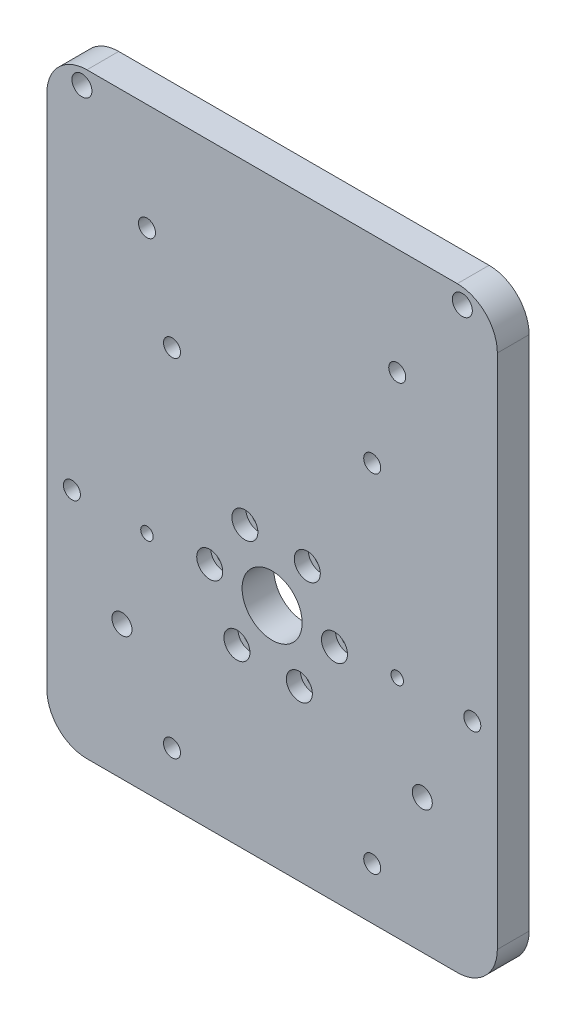
from build123d import *

# Parameters (mm, degrees)
DISCO_1_4IN_START                         = 83.85
DISCO_1_4IN_DEPTH                         = 6.35
BARRENOS_M1_ARO_ESCUADRAS_PASADORES_START = 83.85
CROQUIS16_R                               = 1.45
CROQUIS16_R_2                             = 1.25
CROQUIS16_R_3                             = 6
CROQUIS16_R_4                             = 2
BARRENOS_M1_ARO_ESCUADRAS_PASADORES_DEPTH = 6.35
REFRENTADO_M2_5_START                     = 87.4
CROQUIS17_R                               = 2.6
REFRENTADO_M2_5_DEPTH                     = 2.8
PASO_M3_ESCUADRAS_TUERCA_START            = 83.85
CROQUIS18_R                               = 1.7
PASO_M3_ESCUADRAS_TUERCA_DEPTH            = 6.35
PASO_M3_ARO_TUERCA_START                  = 83.85
CROQUIS19_R                               = 1.7
PASO_M3_ARO_TUERCA_DEPTH                  = 6.35


with BuildPart() as part:
    # Croquis15 → Disco_1-4in (new body)
    with BuildSketch(Plane.XY.offset(DISCO_1_4IN_START)):
        with BuildLine():
            Line((-37, -45), (37, -45))
            ThreePointArc((37, -45), (42.656854249, -42.656854249), (45, -37))
            Line((45, -37), (45, 66.2))
            ThreePointArc((45, 66.2), (42.656854249, 71.856854249), (37, 74.2))
            Line((37, 74.2), (-37, 74.2))
            ThreePointArc((-37, 74.2), (-42.656854249, 71.856854249), (-45, 66.2))
            Line((-45, 66.2), (-45, -37))
            ThreePointArc((-45, -37), (-42.656854249, -42.656854249), (-37, -45))
        make_face()
    extrude(amount=DISCO_1_4IN_DEPTH)

    # Croquis16 → Barrenos_M1_aro_escuadras_pasadores (cut)
    with BuildSketch(Plane.XY.offset(BARRENOS_M1_ARO_ESCUADRAS_PASADORES_START)):
        with Locations(Location((7.026042223, 10.338507178, 0), (0, 0, 180))):
            Circle(CROQUIS16_R)
        with Locations(Location((-5.440388742, 11.253984643, 0), (0, 0, 180))):
            Circle(CROQUIS16_R)
        with Locations(Location((-12.466430965, 0.915477464, 0), (0, 0, 180))):
            Circle(CROQUIS16_R)
        with Locations(Location((-7.026042223, -10.338507178, 0), (0, 0, 180))):
            Circle(CROQUIS16_R)
        with Locations(Location((5.440388742, -11.253984643, 0), (0, 0, 180))):
            Circle(CROQUIS16_R)
        with Locations(Location((12.466430965, -0.915477464, 0), (0, 0, 180))):
            Circle(CROQUIS16_R)
        with Locations(Location((40, 0, 0), (0, 0, 180))):
            Circle(CROQUIS16_R_2)
        with Locations(Location((20, 34.641016151, 0), (0, 0, 180))):
            Circle(CROQUIS16_R_2)
        with Locations(Location((-20, 34.641016151, 0), (0, 0, 180))):
            Circle(CROQUIS16_R_2)
        with Locations(Location((-40, 0, 0), (0, 0, 180))):
            Circle(CROQUIS16_R_2)
        with Locations(Location((-20, -34.641016151, 0), (0, 0, 180))):
            Circle(CROQUIS16_R_2)
        with Locations(Location((20, -34.641016151, 0), (0, 0, 180))):
            Circle(CROQUIS16_R_2)
        with Locations(Location((0, 0, 0), (0, 0, 180))):
            Circle(CROQUIS16_R_3)
        with Locations(Location((-25, 52.85, 0), (0, 0, 180))):
            Circle(CROQUIS16_R_2)
        with Locations(Location((-25, 0, 0), (0, 0, 180))):
            Circle(CROQUIS16_R_2)
        with Locations(Location((25, 52.85, 0), (0, 0, 180))):
            Circle(CROQUIS16_R_2)
        with Locations(Location((25, 0, 0), (0, 0, 180))):
            Circle(CROQUIS16_R_2)
        with Locations(Location((-38, 71.025, 0), (0, 0, 180))):
            Circle(CROQUIS16_R_4)
        with Locations(Location((38, 71.025, 0), (0, 0, 180))):
            Circle(CROQUIS16_R_4)
        with Locations(Location((-30, -18.175, 0), (0, 0, 180))):
            Circle(CROQUIS16_R_4)
        with Locations(Location((30, -18.175, 0), (0, 0, 180))):
            Circle(CROQUIS16_R_4)
    extrude(amount=BARRENOS_M1_ARO_ESCUADRAS_PASADORES_DEPTH, mode=Mode.SUBTRACT)

    # Croquis17 → Refrentado_M2-5 (cut)
    with BuildSketch(Plane.XY.offset(REFRENTADO_M2_5_START)):
        with Locations(Location((7.026042223, 10.338507178, 0), (0, 0, 180))):
            Circle(CROQUIS17_R)
        with Locations(Location((-5.440388742, 11.253984643, 0), (0, 0, 180))):
            Circle(CROQUIS17_R)
        with Locations(Location((-12.466430965, 0.915477464, 0), (0, 0, 180))):
            Circle(CROQUIS17_R)
        with Locations(Location((-7.026042223, -10.338507178, 0), (0, 0, 180))):
            Circle(CROQUIS17_R)
        with Locations(Location((5.440388742, -11.253984643, 0), (0, 0, 180))):
            Circle(CROQUIS17_R)
        with Locations(Location((12.466430965, -0.915477464, 0), (0, 0, 180))):
            Circle(CROQUIS17_R)
    extrude(amount=REFRENTADO_M2_5_DEPTH, mode=Mode.SUBTRACT)

    # Croquis18 → Paso_M3_escuadras_tuerca (cut)
    with BuildSketch(Plane.XY.offset(PASO_M3_ESCUADRAS_TUERCA_START)):
        with Locations(Location((-25, 52.85, 0), (0, 0, 180))):
            Circle(CROQUIS18_R)
        with Locations(Location((25, 52.85, 0), (0, 0, 180))):
            Circle(CROQUIS18_R)
    extrude(amount=PASO_M3_ESCUADRAS_TUERCA_DEPTH, mode=Mode.SUBTRACT)

    # Croquis19 → Paso_M3_aro_tuerca (cut)
    with BuildSketch(Plane.XY.offset(PASO_M3_ARO_TUERCA_START)):
        with Locations(Location((40, 0, 0), (0, 0, 180))):
            Circle(CROQUIS19_R)
        with Locations(Location((20, 34.641016151, 0), (0, 0, 180))):
            Circle(CROQUIS19_R)
        with Locations(Location((-20, 34.641016151, 0), (0, 0, 180))):
            Circle(CROQUIS19_R)
        with Locations(Location((-40, 0, 0), (0, 0, 180))):
            Circle(CROQUIS19_R)
        with Locations(Location((-20, -34.641016151, 0), (0, 0, 180))):
            Circle(CROQUIS19_R)
        with Locations(Location((20, -34.641016151, 0), (0, 0, 180))):
            Circle(CROQUIS19_R)
    extrude(amount=PASO_M3_ARO_TUERCA_DEPTH, mode=Mode.SUBTRACT)


solid = part.part
